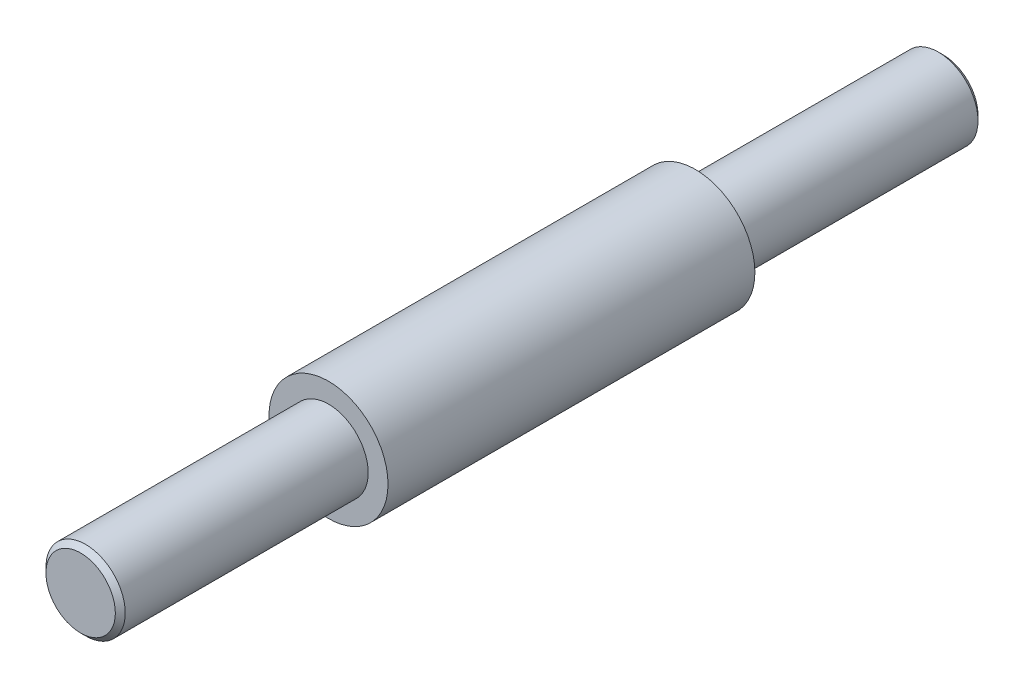
from build123d import *

# Parameters (mm, degrees)
SCHIZZO1_R        = 6
ESTRUSIONE1_DEPTH = 37
SCHIZZO3_R        = 4
ESTRUSIONE2_DEPTH = 25
ESTRUSIONE3_START = 25
SCHIZZO4_R        = 4
ESTRUSIONE3_DEPTH = 25
SMUSSO1_SIZE      = 0.5


with BuildPart() as part:
    # Schizzo1 → Estrusione1 (new body)
    with BuildSketch(Plane.XY):
        Circle(SCHIZZO1_R)
    extrude(amount=ESTRUSIONE1_DEPTH)

    # Schizzo3 → Estrusione2 (add)
    with BuildSketch(Plane.XY.offset(37)):
        Circle(SCHIZZO3_R)
    extrude(amount=ESTRUSIONE2_DEPTH)

    # Schizzo4 → Estrusione3 (add)
    with BuildSketch(Plane(origin=(0, 0, 0), x_dir=(-1, 0, 0), z_dir=(0, 0, -1)).offset(ESTRUSIONE3_START)):
        with Locations(Location((0, 0, 0), (0, 0, 180))):
            Circle(SCHIZZO4_R)
    extrude(amount=-ESTRUSIONE3_DEPTH)

    # Smusso1
    smusso1_edges = [part.edges().sort_by_distance(p)[0] for p in [
        (-4, 0, -25),
        (-4, 0, 62),
    ]]
    chamfer(smusso1_edges, length=SMUSSO1_SIZE)


solid = part.part
